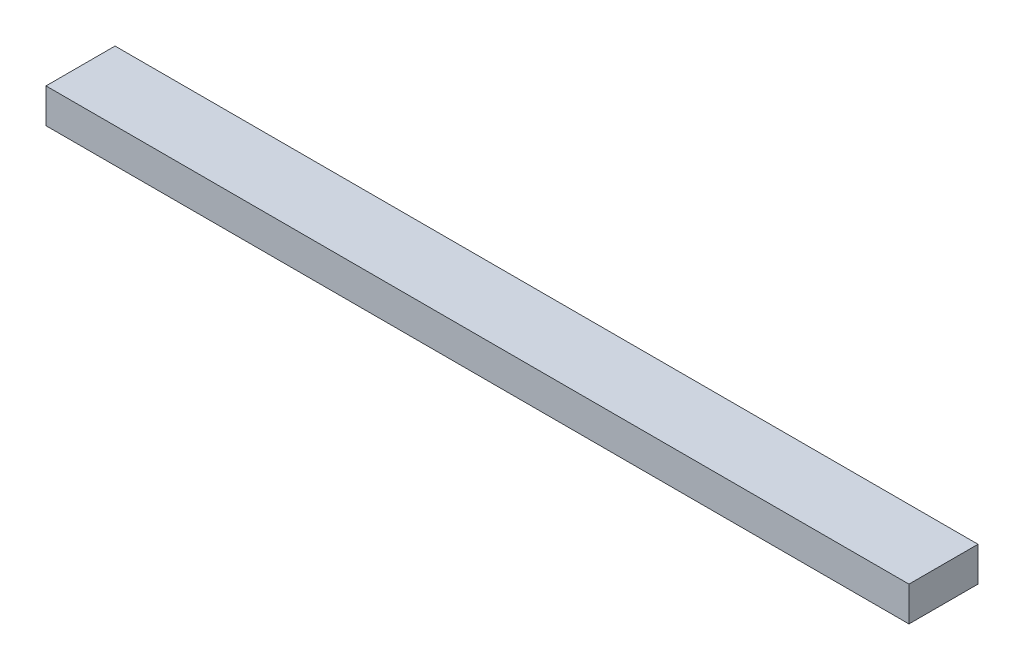
from build123d import *

# Parameters (mm, degrees)
ESQUISSE1_W        = 50
ESQUISSE1_H        = 2
BOSS_EXTRU_1_DEPTH = 4


with BuildPart() as part:
    # Esquisse1 → Boss.-Extru.1 (new body)
    with BuildSketch(Plane.XY):
        Rectangle(ESQUISSE1_W, ESQUISSE1_H)
    extrude(amount=BOSS_EXTRU_1_DEPTH)


solid = part.part
